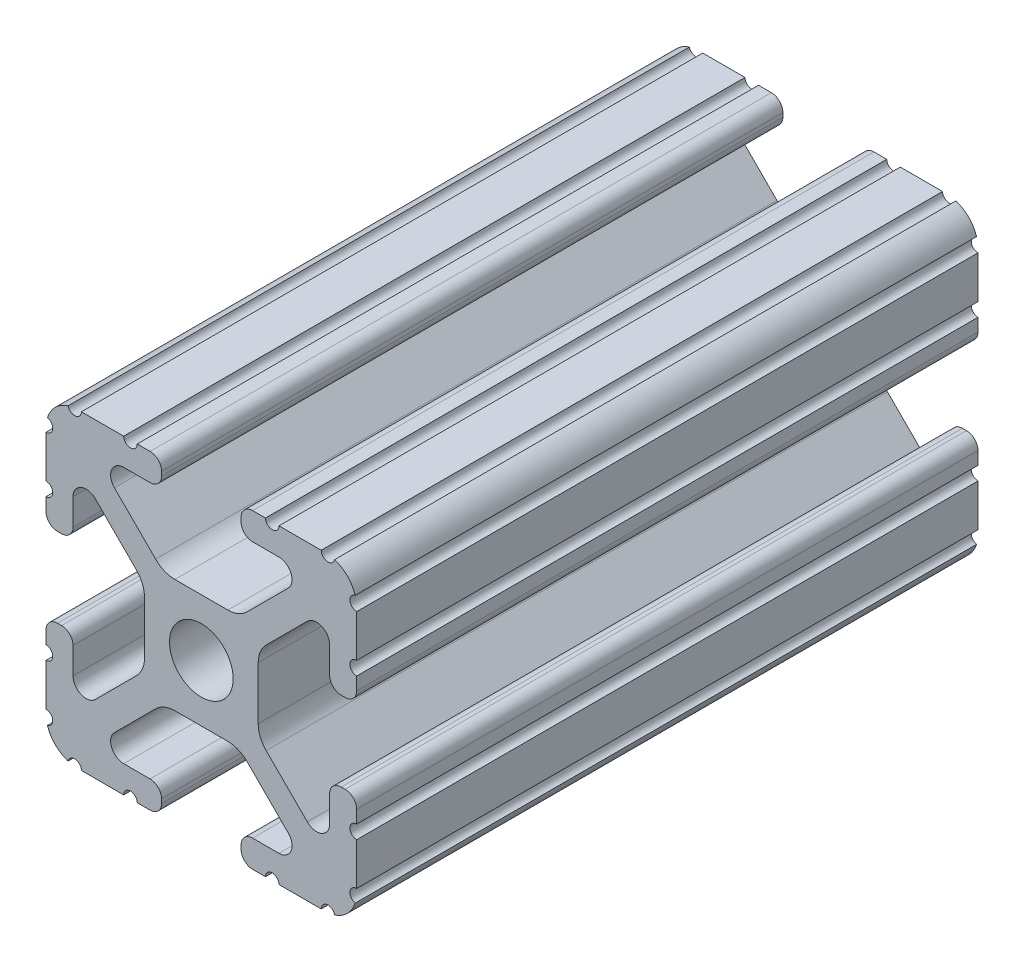
from build123d import *

# Parameters (mm, degrees)
BOSS_EXTRUDE1_DEPTH     = 25.4
CUT_EXTRUDE1_DEPTH      = 32.108519733
CUT_EXTRUDE1_DEPTH_BACK = 32.108519733
SKETCH5_R               = 0.55245


with BuildPart() as part:
    # Sketch4 → Boss-Extrude1 (new, symmetric)
    with BuildSketch(Plane.XY):
        with BuildLine():
            Line((4.190365, -12.7), (10.11729625, -12.7))
            ThreePointArc((10.11729625, -12.7), (11.943543585, -11.943543585), (12.7, -10.11729625))
            Line((12.7, -10.11729625), (12.7, -4.190365))
            ThreePointArc((12.7, -4.190365), (12.42492494, -3.52627506), (11.760835, -3.2512))
            Line((11.760835, -3.2512), (11.429365, -3.2512))
            ThreePointArc((11.429365, -3.2512), (10.76527506, -3.52627506), (10.4902, -4.190365))
            Line((10.4902, -4.190365), (10.4902, -6.348478019))
            ThreePointArc((10.4902, -6.348478019), (9.830707141, -7.335478831), (8.666460301, -7.103895736))
            Line((8.666460301, -7.103895736), (5.299899128, -3.737334563))
            ThreePointArc((5.299899128, -3.737334563), (4.817571085, -3.015479634), (4.6482, -2.16399369))
            Line((4.6482, -2.16399369), (4.6482, 0))
            Line((4.6482, 0), (2.6035, 0))
            ThreePointArc((2.6035, 0), (1.840952505, -1.840952505), (0, -2.6035))
            Line((0, -2.6035), (0, -4.6482))
            Line((0, -4.6482), (2.16399369, -4.6482))
            ThreePointArc((2.16399369, -4.6482), (3.015479634, -4.817571085), (3.737334563, -5.299899128))
            Line((3.737334563, -5.299899128), (7.103895736, -8.666460301))
            ThreePointArc((7.103895736, -8.666460301), (7.335478831, -9.830707141), (6.348478019, -10.4902))
            Line((6.348478019, -10.4902), (4.190365, -10.4902))
            ThreePointArc((4.190365, -10.4902), (3.52627506, -10.76527506), (3.2512, -11.429365))
            Line((3.2512, -11.429365), (3.2512, -11.760835))
            ThreePointArc((3.2512, -11.760835), (3.52627506, -12.42492494), (4.190365, -12.7))
        make_face()
    extrude(amount=BOSS_EXTRUDE1_DEPTH, both=True)

    # Sketch5 → Cut-Extrude1 (cut, two sides: drawn at the far end of the back side and taken through both)
    with BuildSketch(Plane.XY.offset(-CUT_EXTRUDE1_DEPTH_BACK)):
        with Locations((10.356153152, -12.7)):
            Circle(SKETCH5_R)
        with Locations((5.796028019, -12.7)):
            Circle(SKETCH5_R)
        with Locations((12.7, -10.356153152)):
            Circle(SKETCH5_R)
        with Locations((12.7, -5.796028019)):
            Circle(SKETCH5_R)
    extrude(amount=CUT_EXTRUDE1_DEPTH + CUT_EXTRUDE1_DEPTH_BACK, mode=Mode.SUBTRACT)

    # Mirror1: part across plane


with BuildPart() as part_1:
    add(part.part)
    add(part.part.mirror(Plane(origin=(0, 0, 0), x_dir=(0, 0, 1), z_dir=(1, 0, 0))))

    # Mirror2: part across plane


with BuildPart() as part_2:
    add(part_1.part)
    add(part_1.part.mirror(Plane.ZX))


solid = part_2.part
